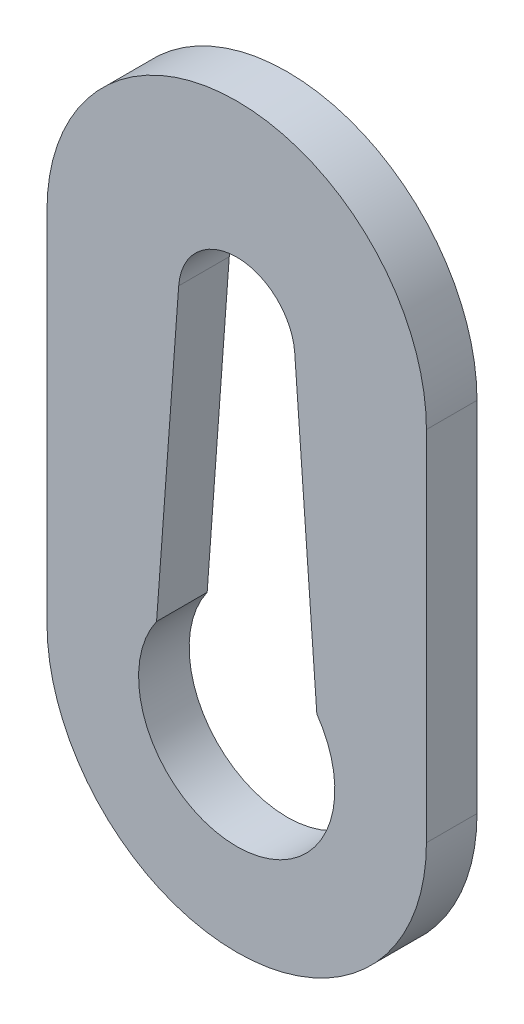
from build123d import *

# Parameters (mm, degrees)
BOSS_EXTRUDE1_DEPTH = 2


with BuildPart() as part:
    # Sketch1 → Boss-Extrude1 (new body)
    with BuildSketch(Plane.XY):
        with BuildLine():
            Line((73.085447554, 59.931475915), (73.085447554, 74.077647485))
            ThreePointArc((73.085447554, 74.077647485), (80.585447554, 81.577647485), (88.085447554, 74.077647485))
            Line((88.085447554, 74.077647485), (88.085447554, 59.931475915))
            ThreePointArc((88.085447554, 59.931475915), (80.585447554, 52.431475915), (73.085447554, 59.931475915))
        make_face()
        with BuildLine():
            Line((78.291593741, 74.09957403), (77.417478776, 62.171649257))
            ThreePointArc((77.417478776, 62.171649257), (80.585447576, 56.052944097), (83.753416376, 62.171649257))
            Line((83.753416376, 62.171649257), (82.879285937, 74.099576949))
            ThreePointArc((82.879285937, 74.099576949), (80.585438483, 76.231471338), (78.291593741, 74.09957403))
        make_face(mode=Mode.SUBTRACT)
    extrude(amount=BOSS_EXTRUDE1_DEPTH)


solid = part.part
